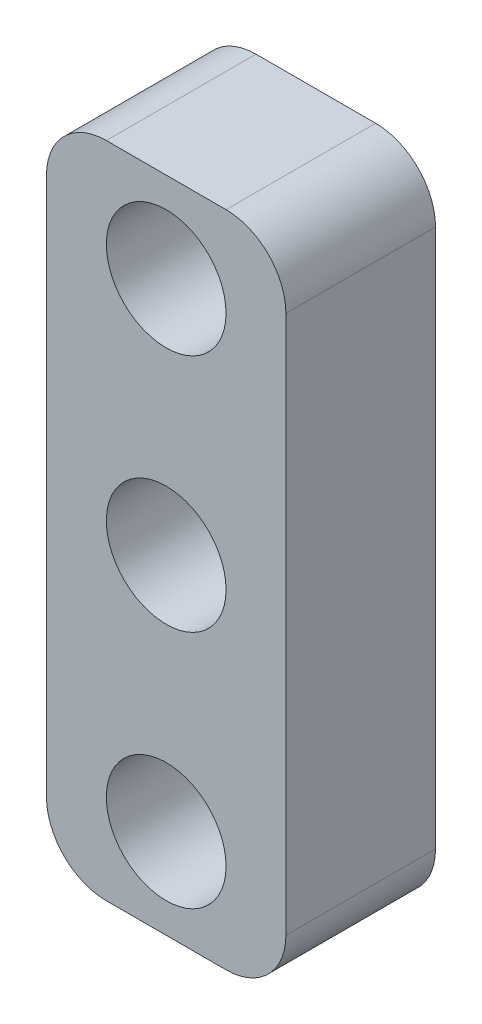
from build123d import *

# Parameters (mm, degrees)
BOSS_EXTRUDE1_DEPTH = 5
SKETCH3_R           = 2
CUT_EXTRUDE2_DEPTH  = 15.491376746


with BuildPart() as part:
    # Sketch1 → Boss-Extrude1 (new body)
    with BuildSketch(Plane.XY):
        with BuildLine():
            Line((0, -9), (0, 9))
            ThreePointArc((0, 9), (0.585786438, 10.414213562), (2, 11))
            Line((2, 11), (6, 11))
            ThreePointArc((6, 11), (7.414213562, 10.414213562), (8, 9))
            Line((8, 9), (8, -9))
            ThreePointArc((8, -9), (7.414213562, -10.414213562), (6, -11))
            Line((6, -11), (2, -11))
            ThreePointArc((2, -11), (0.585786438, -10.414213562), (0, -9))
        make_face()
    extrude(amount=BOSS_EXTRUDE1_DEPTH)

    # Sketch3 → Cut-Extrude2 (cut, through all)
    with BuildSketch(Plane.XY.offset(5)):
        with Locations((4, 0)):
            Circle(SKETCH3_R)
        with Locations((4, 8)):
            Circle(SKETCH3_R)
        with Locations((4, -8)):
            Circle(SKETCH3_R)
    extrude(amount=-CUT_EXTRUDE2_DEPTH, mode=Mode.SUBTRACT)


solid = part.part
